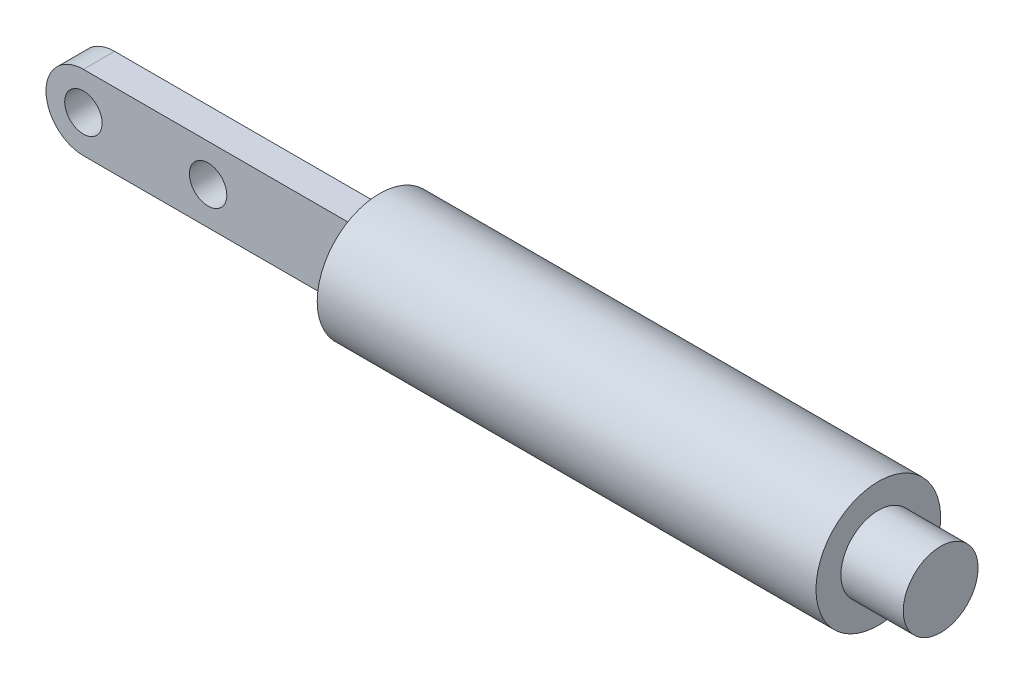
from build123d import *

# Parameters (mm, degrees)
SKETCH2_R           = 3
BOSS_EXTRUDE1_DEPTH = 2.5


with BuildPart() as part:
    # Sketch1 → Revolve1 (revolve)
    with BuildSketch(Plane(origin=(0, 0, 0), x_dir=(1, 0, 0), z_dir=(0, 1, 0)), mode=Mode.PRIVATE) as revolve1_sk:
        Polygon((80, 10), (0, 10), (0, 0), (90, 0), (90, 6), (80, 6), align=None)
    revolve(revolve1_sk.sketch.rotate(Axis((0, 0, 0), (1, 0, 0)), 180), axis=Axis((0, 0, 0), (1, 0, 0)))

    # Sketch2 → Boss-Extrude1 (add, symmetric)
    with BuildSketch(Plane.XY):
        with BuildLine():
            Line((0, -6), (0, 6))
            Line((0, 6), (-45, 6))
            ThreePointArc((-45, 6), (-51, 0), (-45, -6))
            Line((-45, -6), (0, -6))
        make_face()
        with Locations((-25, 0)):
            Circle(SKETCH2_R, mode=Mode.SUBTRACT)
        with Locations((-45, 0)):
            Circle(SKETCH2_R, mode=Mode.SUBTRACT)
    extrude(amount=BOSS_EXTRUDE1_DEPTH, both=True)


solid = part.part
